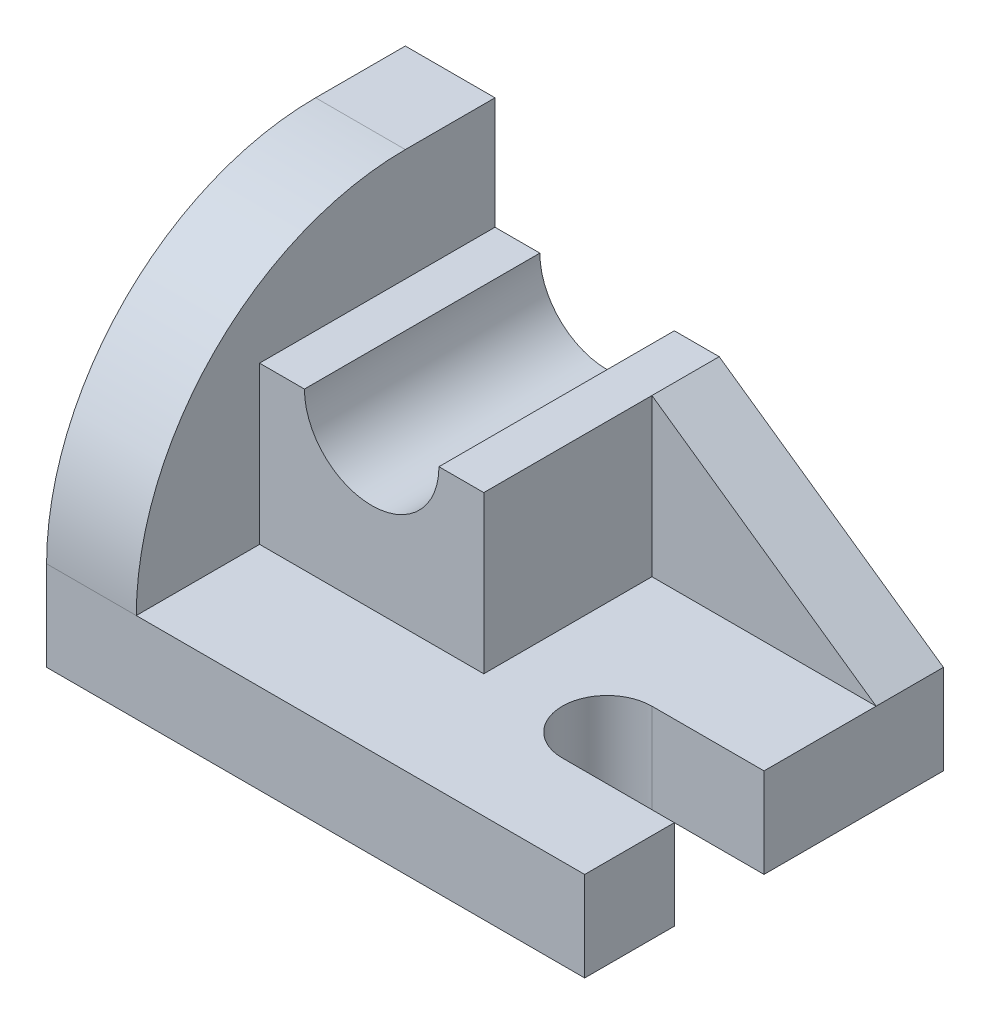
from build123d import *

# Parameters (mm, degrees)
SKETCH3_W           = 96
SKETCH3_H           = 64
BOSS_EXTRUDE1_DEPTH = 16
CUT_EXTRUDE1_DEPTH  = 16
BOSS_EXTRUDE2_DEPTH = 16
SKETCH6_W           = 40
SKETCH6_H           = 42
BOSS_EXTRUDE3_DEPTH = 28
SKETCH7_R           = 12
CUT_EXTRUDE2_DEPTH  = 46
BOSS_EXTRUDE4_DEPTH = 12


with BuildPart() as part:
    # Sketch3 → Boss-Extrude1 (new body)
    with BuildSketch(Plane(origin=(0, 0, 0), x_dir=(1, 0, 0), z_dir=(0, 1, 0))):
        with Locations((48, 32)):
            Rectangle(SKETCH3_W, SKETCH3_H)
    extrude(amount=BOSS_EXTRUDE1_DEPTH)

    # Sketch4 → Cut-Extrude1 (cut)
    with BuildSketch(Plane(origin=(0, 16, 0), x_dir=(1, 0, 0), z_dir=(0, 1, 0))):
        with BuildLine():
            Line((96, 16), (76, 16))
            ThreePointArc((76, 16), (68, 24), (76, 32))
            Line((76, 32), (96, 32))
            ThreePointArc((96, 32), (104, 24), (96, 16))
        make_face()
    extrude(amount=-CUT_EXTRUDE1_DEPTH, mode=Mode.SUBTRACT)

    # Sketch5 → Boss-Extrude2 (add)
    with BuildSketch(Plane.ZY):
        with BuildLine():
            Line((-64, 0), (0, 0))
            Line((0, 0), (0, 16))
            ThreePointArc((0, 16), (-14.058874503, 49.941125497), (-48, 64))
            Line((-48, 64), (-64, 64))
            Line((-64, 64), (-64, 0))
        make_face()
    extrude(amount=-BOSS_EXTRUDE2_DEPTH)

    # Sketch6 → Boss-Extrude3 (add)
    with BuildSketch(Plane(origin=(0, 16, 0), x_dir=(1, 0, 0), z_dir=(0, 1, 0))):
        with Locations((36, 43)):
            Rectangle(SKETCH6_W, SKETCH6_H)
    extrude(amount=BOSS_EXTRUDE3_DEPTH)

    # Sketch7 → Cut-Extrude2 (cut)
    with BuildSketch(Plane.XY.offset(-22)):
        with Locations((36, 44)):
            Circle(SKETCH7_R)
    extrude(amount=-CUT_EXTRUDE2_DEPTH, mode=Mode.SUBTRACT)

    # Sketch11 → Boss-Extrude4 (add)
    with BuildSketch(Plane(origin=(0, 0, -64), x_dir=(-1, 0, 0), z_dir=(0, 0, -1))):
        Polygon((-56, 44), (-96, 16), (-56, 16), align=None)
    extrude(amount=-BOSS_EXTRUDE4_DEPTH)


solid = part.part
